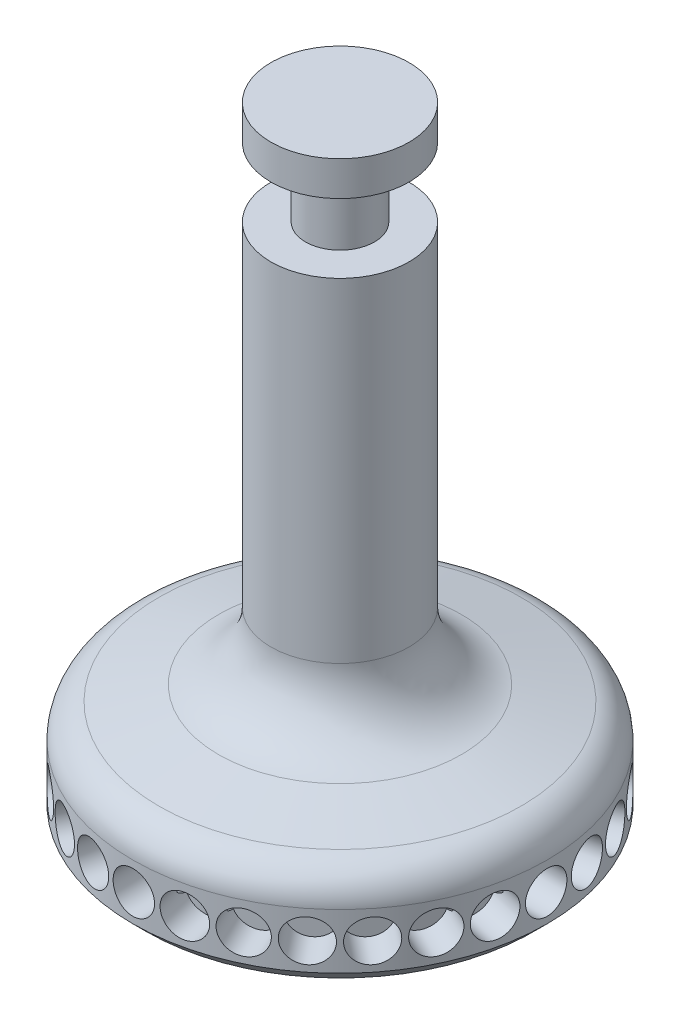
from build123d import *

# Parameters (mm, degrees)
CUT_EXTRUDE1_START  = 50
SKETCH3_R           = 3
CUT_EXTRUDE1_DEPTH  = 25
CIRPATTERN1_COUNT   = 28
BOSS_EXTRUDE1_START = 25
SKETCH4_R           = 10
BOSS_EXTRUDE1_DEPTH = 25
SKETCH4_3_R         = 5
BOSS_EXTRUDE2_DEPTH = 40
SKETCH5_R           = 10
BOSS_EXTRUDE3_DEPTH = 5


with BuildPart() as part:
    # Sketch1 → Revolve3 (revolve)
    with BuildSketch(Plane(origin=(0, 0, 0), x_dir=(0, 0, -1), z_dir=(1, 0, 0))):
        with BuildLine():
            Line((26.209609478, -35.148521369), (17.580781044, -32.997112808))
            ThreePointArc((17.580781044, -32.997112808), (12.119892464, -29.450770299), (10, -23.294155546))
            Line((10, -23.294155546), (10, 0))
            Line((10, 0), (0, 0))
            Line((0, 0), (0, -50))
            Line((0, -50), (28, -50))
            Line((28, -50), (30, -48))
            Line((30, -48), (30, -40))
            ThreePointArc((30, -40), (28.940053768, -36.921692623), (26.209609478, -35.148521369))
        make_face()
    revolve(axis=Axis((0, 0, 0), (0, -1, 0)))

    # Sketch3 → Cut-Extrude1 (cut)
    with BuildSketch(Plane(origin=(0, 0, 0), x_dir=(0, 0, -1), z_dir=(1, 0, 0)).offset(CUT_EXTRUDE1_START)):
        with Locations((0, -44.054454318)):
            Circle(SKETCH3_R)
    cut_extrude1 = extrude(amount=-CUT_EXTRUDE1_DEPTH, mode=Mode.SUBTRACT)

    # CirPattern1: Cut-Extrude1 ×28 about axis
    cirpattern1_axis = Axis((0, -48, 0), (0, 1, 0))
    for i in range(1, CIRPATTERN1_COUNT):
        add(cut_extrude1.rotate(cirpattern1_axis, i * 360 / CIRPATTERN1_COUNT), mode=Mode.SUBTRACT)

    # Sketch4 → Boss-Extrude1 (add)
    with BuildSketch(Plane(origin=(0, 0, 0), x_dir=(1, 0, 0), z_dir=(0, 1, 0)).offset(BOSS_EXTRUDE1_START)):
        Circle(SKETCH4_R)
    extrude(amount=-BOSS_EXTRUDE1_DEPTH)

    # Sketch4<3> → Boss-Extrude2 (add)
    with BuildSketch(Plane(origin=(0, 0, 0), x_dir=(1, 0, 0), z_dir=(0, 1, 0))):
        Circle(SKETCH4_3_R)
    extrude(amount=BOSS_EXTRUDE2_DEPTH)

    # Sketch5 → Boss-Extrude3 (add)
    with BuildSketch(Plane(origin=(0, 40, 0), x_dir=(1, 0, 0), z_dir=(0, 1, 0))):
        Circle(SKETCH5_R)
    extrude(amount=-BOSS_EXTRUDE3_DEPTH)


solid = part.part
